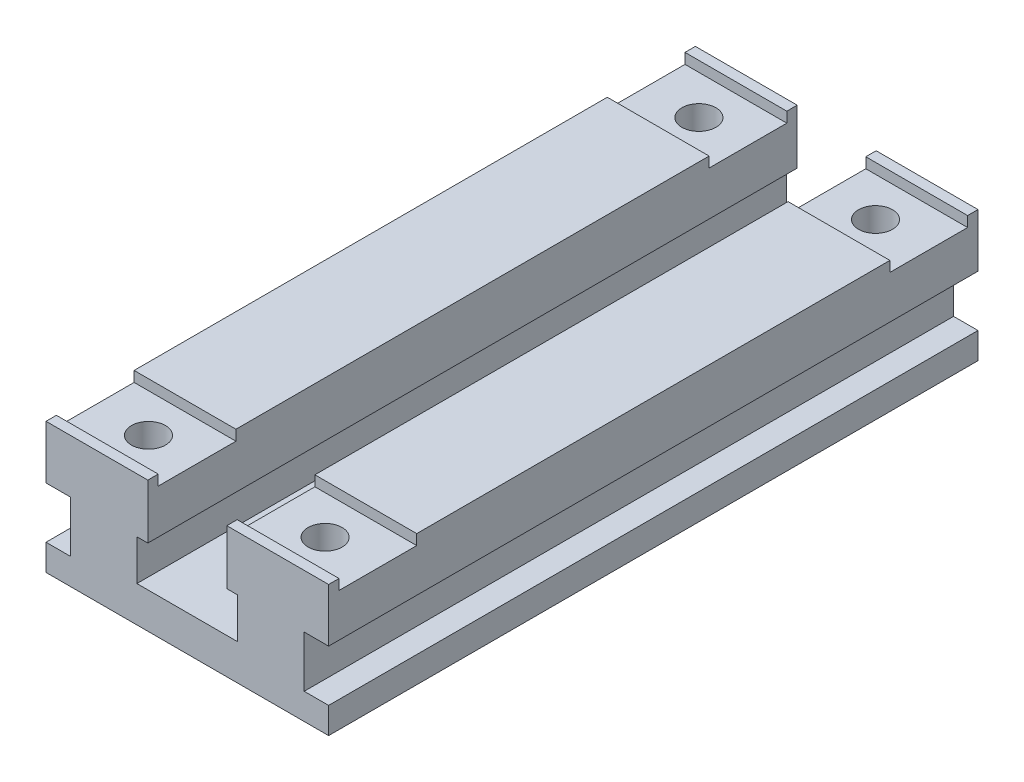
from build123d import *

# Parameters (mm, degrees)
EXTRUDE1_DEPTH     = 158.75
SKETCH2_W          = 18.9992
SKETCH2_H          = 9.56647298
CUT_EXTRUDE1_DEPTH = 158.75
SKETCH3_R          = 4.15925
CUT_EXTRUDE2_DEPTH = 158.75
SKETCH4_R          = 6.25475
CUT_EXTRUDE3_DEPTH = 8.8392
EXTRUDE2_REACH     = 172.226


with BuildPart() as part:
    # Sketch1 → Extrude1 (new body)
    with BuildSketch(Plane.XY):
        Polygon((-16.638134778, 6.4008), (-16.638134778, 0), (52.449865222, 0), (52.449865222, 6.4008), (46.480865222, 6.4008), (46.480865222, 18.9484), (52.449865222, 18.9484), (52.449865222, 32.004), (-16.638134778, 32.004), (-16.638134778, 18.9484), (-10.669134778, 18.9484), (-10.669134778, 6.4008), align=None)
    extrude(amount=EXTRUDE1_DEPTH)

    # Sketch2 → Cut-Extrude1 (cut)
    with BuildSketch(Plane.ZY.offset(16.638134778)):
        with Locations((12.0396, 34.24723649)):
            Rectangle(SKETCH2_W, SKETCH2_H)
        with Locations((146.7104, 34.24723649)):
            Rectangle(SKETCH2_W, SKETCH2_H)
    extrude(amount=-CUT_EXTRUDE1_DEPTH, mode=Mode.SUBTRACT)

    # Sketch3 → Cut-Extrude2 (cut)
    with BuildSketch(Plane(origin=(0, 29.464, 0), x_dir=(-1, 0, 0), z_dir=(0, 1, 0))):
        with Locations(Location((3.684134778, 12.09675, 0), (0, 0, 90))):
            Circle(SKETCH3_R)
        with Locations(Location((-39.495865222, 12.09675, 0), (0, 0, 90))):
            Circle(SKETCH3_R)
        with Locations(Location((-39.495865222, 146.65325, 0), (0, 0, 90))):
            Circle(SKETCH3_R)
        with Locations(Location((3.684134778, 146.65325, 0), (0, 0, 90))):
            Circle(SKETCH3_R)
    extrude(amount=-CUT_EXTRUDE2_DEPTH, mode=Mode.SUBTRACT)

    # Sketch4 → Cut-Extrude3 (cut)
    with BuildSketch(Plane.XZ):
        with Locations(Location((-3.684134778, 146.65325, 0), (0, 0, 270))):
            Circle(SKETCH4_R)
        with Locations(Location((39.495865222, 146.65325, 0), (0, 0, 270))):
            Circle(SKETCH4_R)
        with Locations(Location((39.495865222, 12.09675, 0), (0, 0, 90))):
            Circle(SKETCH4_R)
        with Locations(Location((-3.684134778, 12.09675, 0), (0, 0, 90))):
            Circle(SKETCH4_R)
    extrude(amount=-CUT_EXTRUDE3_DEPTH, mode=Mode.SUBTRACT)

    # Sketch5 → Extrude2 (cut, up to next)
    with BuildSketch(Plane.XY, mode=Mode.PRIVATE) as extrude2_sk1:
        Polygon((8.253865222, 18.669), (5.586865222, 18.669), (5.586865222, 8.763), (30.224865222, 8.763), (30.224865222, 18.669), (27.557865222, 18.669), (27.557865222, 32.004), (8.253865222, 32.004), align=None)
    extrude2_tool1 = extrude(extrude2_sk1.sketch, amount=EXTRUDE2_REACH, mode=Mode.PRIVATE) & part.part
    add(extrude2_tool1.solids().sort_by_distance((17.905865, 19.680981, 0))[0], mode=Mode.SUBTRACT)


solid = part.part
